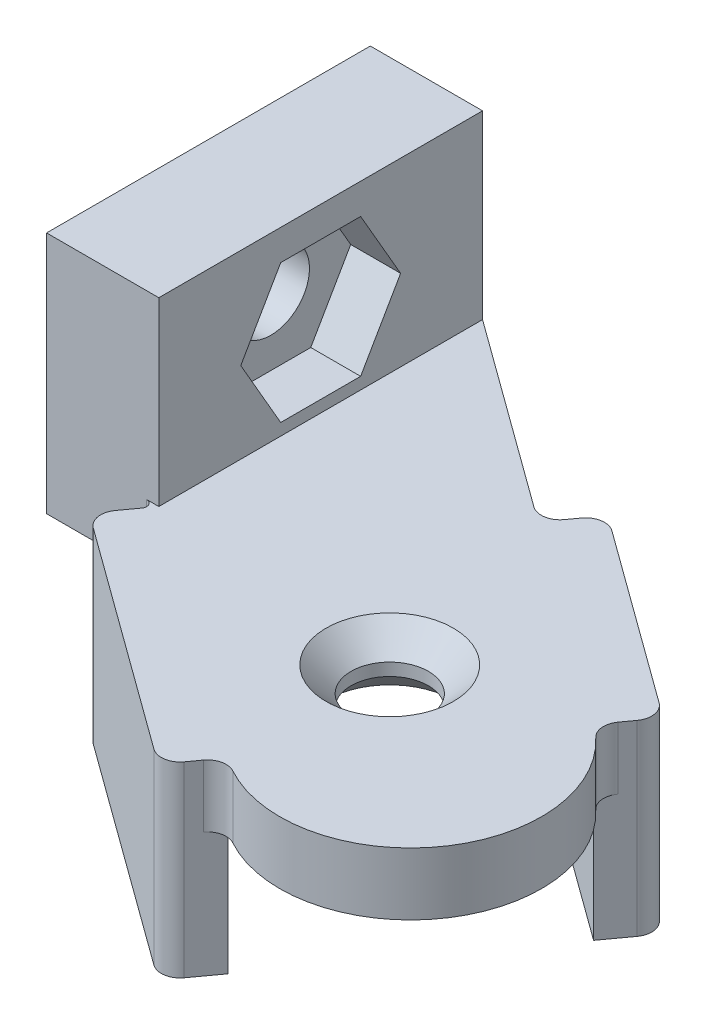
from build123d import *

# Parameters (mm, degrees)
SKETCH_1_R          = 1.55
EXTRUDE_511_DEPTH   = 2.5
EXTRUDE_START       = 2.5
EXTRUDE_978_DEPTH   = 7.5
SKETCH_3_W          = 4.5
SKETCH_3_H          = 12.978713764
EXTRUDE_1_DEPTH     = 9.75
CHAMFER_1_SIZE      = 1
FILLET_5_R          = 0.75
CUT_EXTRUDE_1_DEPTH = 2
SKETCH_7_R          = 1.55
CUT_EXTRUDE_2_DEPTH = 4.5
FILLET_6_R          = 0.25


with BuildPart() as part:
    # 草图1 → Extrude 511 (new body)
    with BuildSketch(Plane(origin=(0, 0, 0), x_dir=(1, 0, 0), z_dir=(0, 1, 0))):
        with BuildLine():
            Line((-10.1243866, 13.845154317), (6.15423406, 2.01804411))
            ThreePointArc((6.15423406, 2.01804411), (7.315700706, -5.315167685), (-0.017511089, -6.476634331))
            Line((-0.017511089, -6.476634331), (-10.1243866, 0.866440553))
            Line((-10.1243866, 0.866440553), (-10.1243866, 13.845154317))
        make_face()
        with Locations(Location((0, 0, 0), (0, 0, 270))):
            Circle(SKETCH_1_R, mode=Mode.SUBTRACT)
    extrude(amount=EXTRUDE_511_DEPTH)

    # 草图2 → Extrude 978 (add)
    with BuildSketch(Plane(origin=(0, 0, 0), x_dir=(1, 0, 0), z_dir=(0, 1, 0)).offset(EXTRUDE_START)):
        Polygon((-10.1243866, 0.866440553), (-0.017511089, -6.476634331), (-1.193081594, -8.09466832), (-11.299957105, -0.751593436), align=None)
        Polygon((7.329804565, 3.636078099), (-0.809505765, 9.549633202), (-1.98507627, 7.931599213), (6.15423406, 2.01804411), align=None)
    extrude(amount=-EXTRUDE_978_DEPTH)

    # 草图3 → 限位-1 (add)
    with BuildSketch(Plane(origin=(0, 0, 0), x_dir=(1, 0, 0), z_dir=(0, 1, 0))):
        with Locations((-12.3743866, 7.355797435)):
            Rectangle(SKETCH_3_W, SKETCH_3_H)
    extrude(amount=EXTRUDE_1_DEPTH)

    # 倒角1
    chamfer_1_edges = [part.edges().sort_by_distance(p)[0] for p in [
        (0, 0, -1.55),
        (0, 2.5, -1.55),
    ]]
    chamfer(chamfer_1_edges, length=CHAMFER_1_SIZE)

    # 圆角5
    fillet_5_edges = [part.edges().sort_by_distance(p)[0] for p in [
        (-1.193081594, -1.25, 8.09466832),
        (-11.299957105, -1.25, 0.751593436),
        (-1.98507627, 1.25, -7.931599213),
        (-0.809505765, -1.25, -9.549633202),
        (7.329804565, -1.25, -3.636078099),
        (-0.017511089, 1.25, 6.476634331),
        (6.15423406, 1.25, -2.01804411),
    ]]
    fillet(fillet_5_edges, radius=FILLET_5_R)

    # 草图5 → 切除-拉伸1 (cut)
    with BuildSketch(Plane(origin=(-10.1243866, 0, 0), x_dir=(0, 0, -1), z_dir=(1, 0, 0))):
        Polygon((10.560091429, 5.75), (8.957944432, 8.525), (5.753650438, 8.525), (4.151503441, 5.75), (5.753650438, 2.975), (8.957944432, 2.975), align=None)
    extrude(amount=-CUT_EXTRUDE_1_DEPTH, mode=Mode.SUBTRACT)

    # 草图7 → 切除-拉伸2 (cut)
    with BuildSketch(Plane(origin=(-10.1243866, 0, 0), x_dir=(0, 0, -1), z_dir=(1, 0, 0))):
        with Locations((7.355797435, 5.75)):
            Circle(SKETCH_7_R)
    extrude(amount=-CUT_EXTRUDE_2_DEPTH, mode=Mode.SUBTRACT)

    # 圆角6
    fillet_6_edges = [part.edges().sort_by_distance(p)[0] for p in [
        (-10.1243866, 1.25, -0.866440553),
    ]]
    fillet(fillet_6_edges, radius=FILLET_6_R)


solid = part.part
